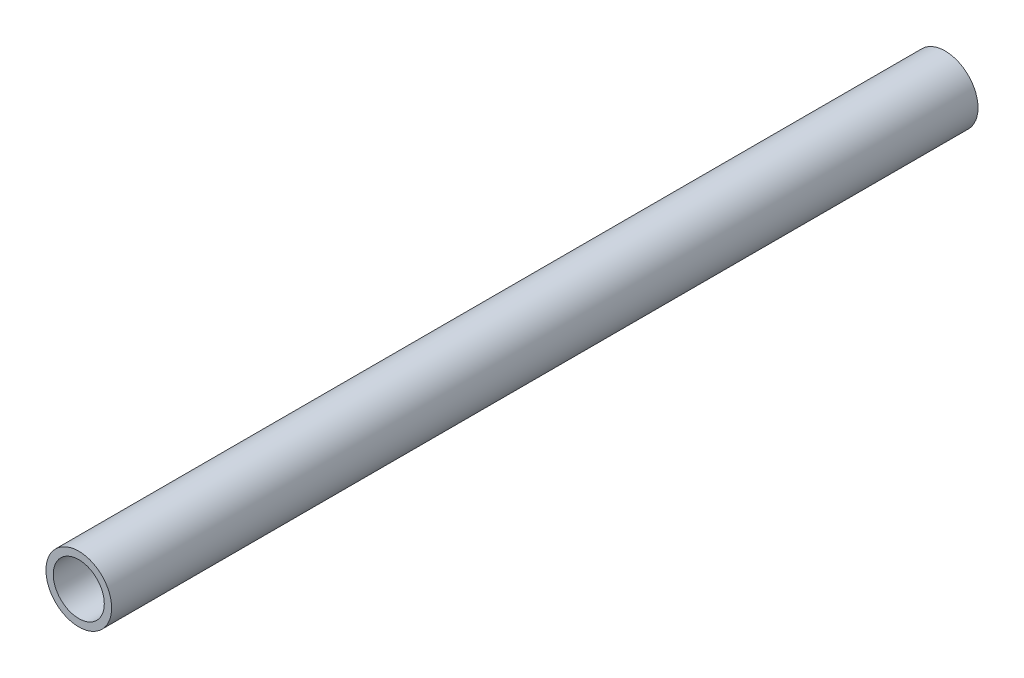
from build123d import *

# Parameters (mm, degrees)
SKETCH1_R           = 9
SKETCH1_R_2         = 7
BOSS_EXTRUDE1_DEPTH = 237.54


with BuildPart() as part:
    # Sketch1 → Boss-Extrude1 (new body)
    with BuildSketch(Plane.XY):
        Circle(SKETCH1_R)
        Circle(SKETCH1_R_2, mode=Mode.SUBTRACT)
    extrude(amount=BOSS_EXTRUDE1_DEPTH)


solid = part.part
